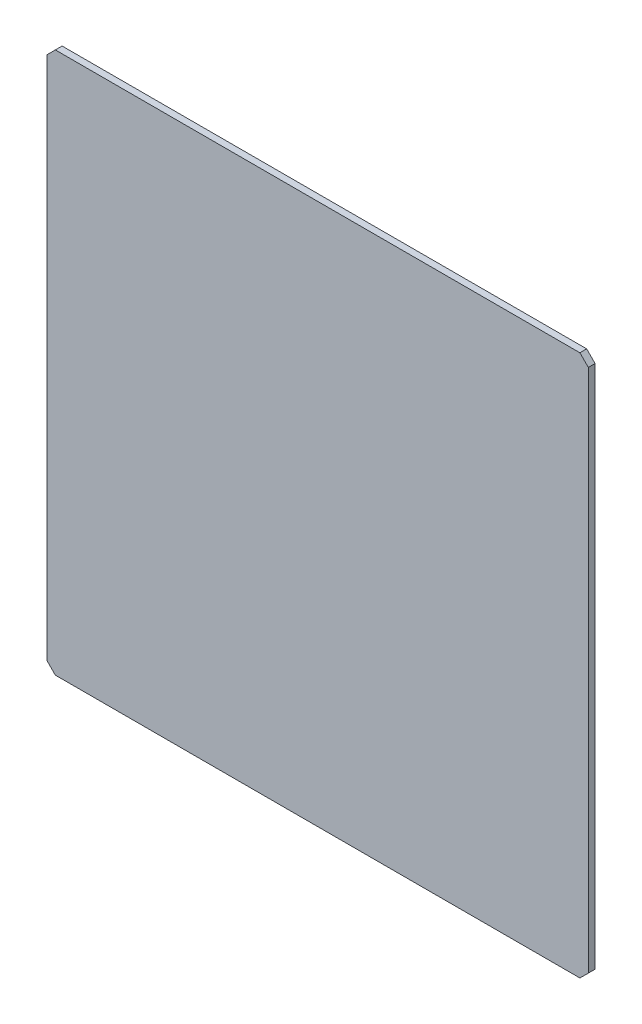
from build123d import *

# Parameters (mm, degrees)
SKETCH2_W           = 320
SKETCH2_H           = 320
BOSS_EXTRUDE1_DEPTH = 4
CHAMFER1_SIZE       = 5


with BuildPart() as part:
    # Sketch2 → Boss-Extrude1 (new body)
    with BuildSketch(Plane.XY):
        Rectangle(SKETCH2_W, SKETCH2_H)
    extrude(amount=BOSS_EXTRUDE1_DEPTH)

    # Chamfer1
    chamfer1_edges = [part.edges().sort_by_distance(p)[0] for p in [
        (160, -160, 2),
        (-160, -160, 2),
        (-160, 160, 2),
        (160, 160, 2),
    ]]
    chamfer(chamfer1_edges, length=CHAMFER1_SIZE)


solid = part.part
